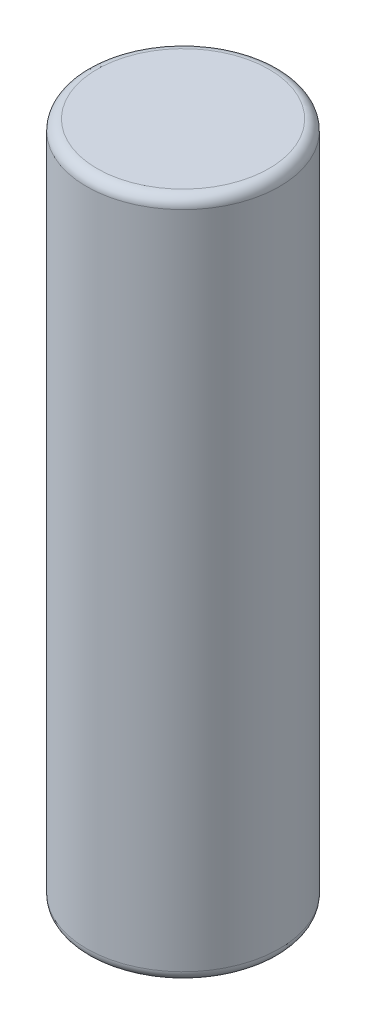
from build123d import *

# Parameters (mm, degrees)
SKETCH_1_R      = 9.25
EXTRUDE_1_DEPTH = 32.65
FILLET_1_R      = 1


with BuildPart() as part:
    # 스케치1 → 보스-돌출1 (new, symmetric)
    with BuildSketch(Plane(origin=(0, 0, 0), x_dir=(1, 0, 0), z_dir=(0, 1, 0))):
        with Locations(Location((0, 0, 0), (0, 0, 270))):
            Circle(SKETCH_1_R)
    extrude(amount=EXTRUDE_1_DEPTH, both=True)

    # 필렛1
    fillet_1_edges = [part.edges().sort_by_distance(p)[0] for p in [
        (0, -32.65, -9.25),
        (0, 32.65, -9.25),
    ]]
    fillet(fillet_1_edges, radius=FILLET_1_R)


solid = part.part
